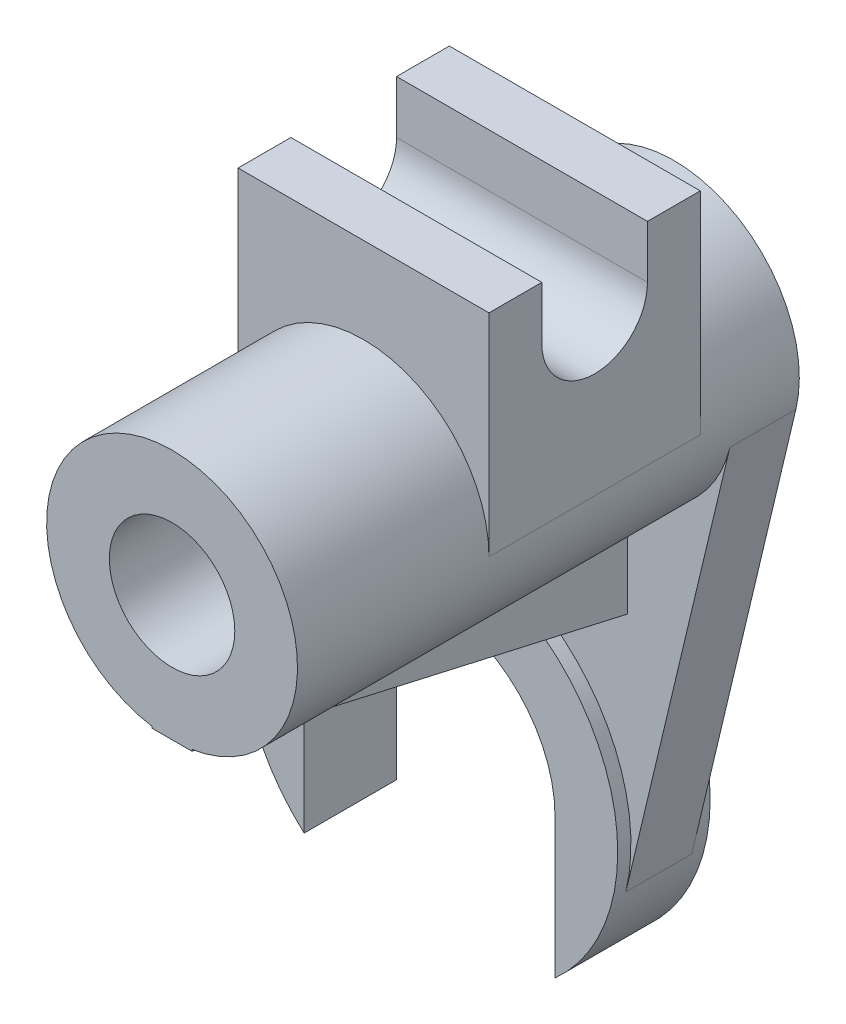
from build123d import *

# Parameters (mm, degrees)
SKETCH1_R                = 19
BOSS_EXTRUDE1_DEPTH      = 38
BOSS_EXTRUDE2_DEPTH      = 2
BOSS_EXTRUDE2_DEPTH_BACK = 12
BOSS_EXTRUDE3_START      = -10
BOSS_EXTRUDE3_DEPTH      = 10
BOSS_EXTRUDE4_DEPTH      = 19
HOLE1_D                  = 16
HOLE1_DEPTH              = 100
HOLE2_D                  = 19
HOLE2_DEPTH              = 100
BOSS_EXTRUDE5_DEPTH      = 3


with BuildPart() as part:
    # Sketch1 → Boss-Extrude1 (new, symmetric)
    with BuildSketch(Plane.XY):
        Circle(SKETCH1_R)
    extrude(amount=BOSS_EXTRUDE1_DEPTH, both=True)



with BuildPart() as body_2:
    # Sketch2 → Boss-Extrude2 (new, two sides: drawn at the far end of the back side and taken through both)
    with BuildSketch(Plane(origin=(0, 0, -38), x_dir=(-1, 0, 0), z_dir=(0, 0, -1)).offset(-BOSS_EXTRUDE2_DEPTH_BACK)):
        with BuildLine():
            Line((6, -64), (6, -85.242645786))
            ThreePointArc((6, -85.242645786), (25, -35.5), (44, -85.242645786))
            Line((44, -85.242645786), (44, -64))
            ThreePointArc((44, -64), (25, -45), (6, -64))
        make_face()
    extrude(amount=BOSS_EXTRUDE2_DEPTH + BOSS_EXTRUDE2_DEPTH_BACK)


with BuildPart() as part_1:
    add(part.part)

    add(body_2.part)  # Boss-Extrude3 merges body 2
    # Sketch3 → Boss-Extrude3 (add)
    with BuildSketch(Plane(origin=(0, 0, -38), x_dir=(-1, 0, 0), z_dir=(0, 0, -1)).offset(BOSS_EXTRUDE3_START)):
        with BuildLine():
            Line((-18.483548174, -4.399823506), (-2.725322262, -70.599735258))
            ThreePointArc((-2.725322262, -70.599735258), (14.630259976, -37.45346554), (49.857815378, -50.059447118))
            Line((49.857815378, -50.059447118), (16.571876918, 9.293701921))
            ThreePointArc((16.571876918, 9.293701921), (6.913160016, -17.69768964), (-18.483548174, -4.399823506))
        make_face()
    extrude(amount=BOSS_EXTRUDE3_DEPTH)

    # Sketch4 → Boss-Extrude4 (add, symmetric)
    with BuildSketch(Plane(origin=(0, 0, 0), x_dir=(0, 0, -1), z_dir=(1, 0, 0))):
        with BuildLine():
            Line((-9, 0), (-9, 32))
            Line((-9, 32), (-1, 32))
            Line((-1, 32), (-1, 24))
            ThreePointArc((-1, 24), (7, 16), (15, 24))
            Line((15, 24), (15, 32))
            Line((15, 32), (23, 32))
            Line((23, 32), (23, 0))
            Line((23, 0), (-9, 0))
        make_face()
    extrude(amount=BOSS_EXTRUDE4_DEPTH, both=True)

    # Hole1
    with Locations(Plane(origin=(19, 0, 0), x_dir=(0, 0, -1), z_dir=(1, 0, 0))):
        with Locations((7, 24)):
            Hole(HOLE1_D / 2, depth=HOLE1_DEPTH)

    # Hole2
    with Locations(Plane.XY.offset(38)):
        with Locations((0, 0)):
            Hole(HOLE2_D / 2, depth=HOLE2_DEPTH)

    # Sketch10 → Boss-Extrude5 (add, symmetric)
    with BuildSketch(Plane(origin=(0, 0, 0), x_dir=(0, 0, -1), z_dir=(1, 0, 0))):
        Polygon((-38, -19), (28, -34), (30, -34), (30, -17), (-38, -17), align=None)
    extrude(amount=BOSS_EXTRUDE5_DEPTH, both=True)


solid = part_1.part
